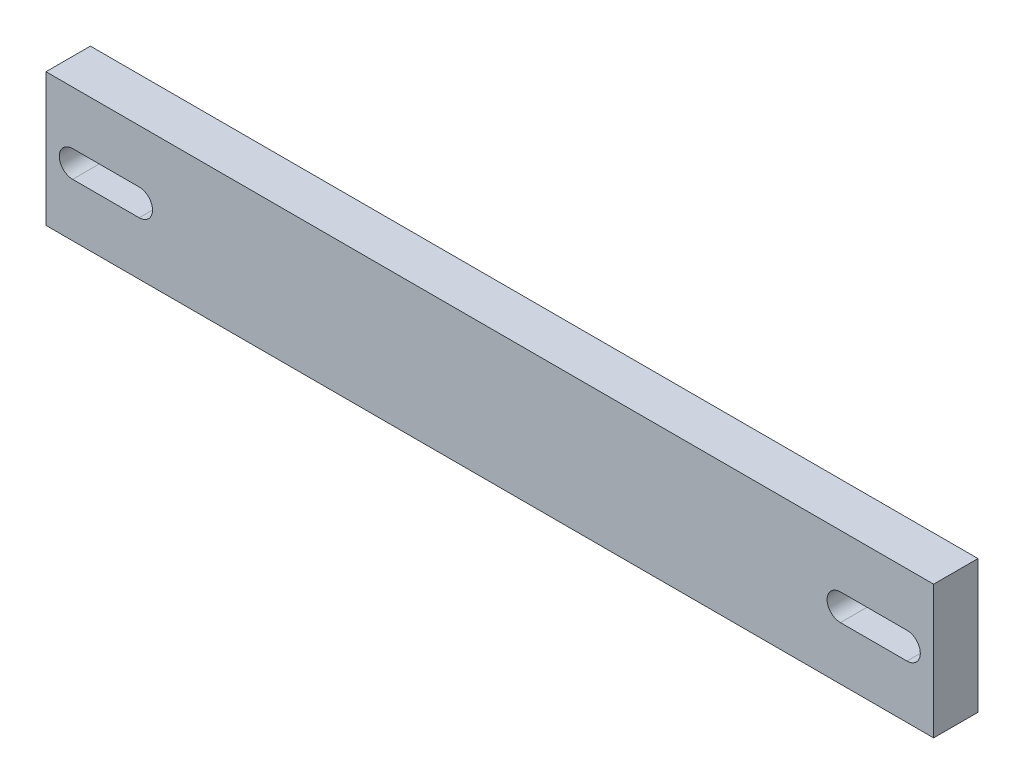
from build123d import *

# Parameters (mm, degrees)
SKETCH1_W           = 200
SKETCH1_H           = 30
BOSS_EXTRUDE1_DEPTH = 10


with BuildPart() as part:
    # Sketch1 → Boss-Extrude1 (new body)
    with BuildSketch(Plane.XY):
        Rectangle(SKETCH1_W, SKETCH1_H)
        with BuildLine():
            Line((-94, 3), (-79, 3))
            ThreePointArc((-79, 3), (-76, 0), (-79, -3))
            Line((-79, -3), (-94, -3))
            ThreePointArc((-94, -3), (-97, 0), (-94, 3))
        make_face(mode=Mode.SUBTRACT)
        with BuildLine():
            Line((94, 3), (79, 3))
            ThreePointArc((79, 3), (76, 0), (79, -3))
            Line((79, -3), (94, -3))
            ThreePointArc((94, -3), (97, 0), (94, 3))
        make_face(mode=Mode.SUBTRACT)
    extrude(amount=BOSS_EXTRUDE1_DEPTH)


solid = part.part
